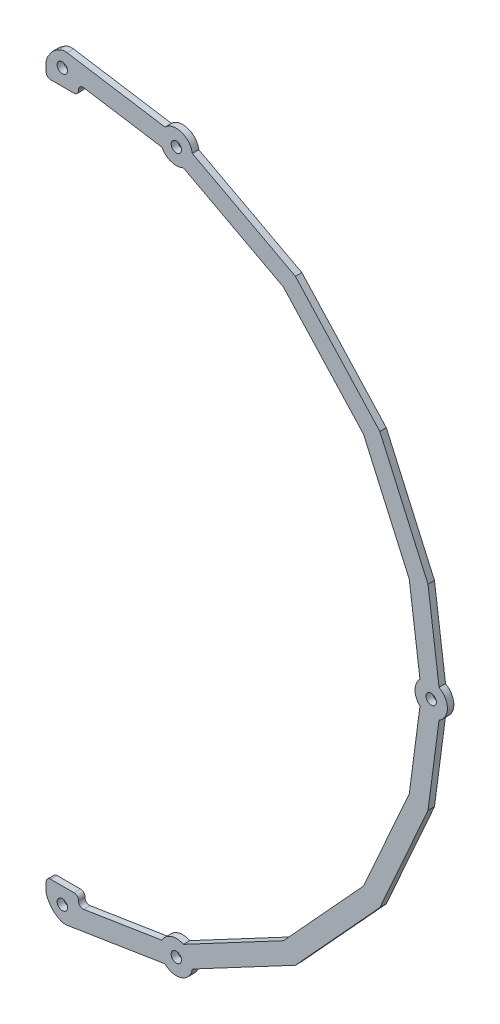
from build123d import *

# Parameters (mm, degrees)
EXTRUDE_180_DEPTH      = 8
EXTRUDE_START          = 8
SKETCH_2_W             = 6
SKETCH_2_H             = 4
EXTRUDE_457_DEPTH      = 36
EXTRUDE_START_2        = 44
EXTRUDE_180_2_DEPTH    = 3
SKETCH_4_R             = 20
SKETCH_4_R_2           = 4
EXTRUDE_692_DEPTH      = 3
EXTRUDE_745_DEPTH      = 3
EXTRUDE_1_DEPTH        = 3
EXTRUDE_Y_1_DEPTH      = 3
EXTRUDE_1_2_DEPTH      = 3
EXTRUDE_Y_1_2_DEPTH    = 3
CUT_EXTRUDE_START      = 44
CUT_EXTRUDE_1134_DEPTH = 3
SKETCH_11_R            = 5
EXTRUDE_1203_DEPTH     = 3
EXTRUDE_1416_DEPTH     = 8
SKETCH_13_R            = 1.6
CUT_EXTRUDE_1487_DEPTH = 3
SKETCH_14_R            = 1.6
CUT_EXTRUDE_1548_DEPTH = 8
CUT_EXTRUDE_START_2    = 8
SKETCH_15_W            = 600
SKETCH_15_H            = 600
CUT_EXTRUDE_1608_DEPTH = 60
F_2MM_DEPTH            = 8
SKETCH_17_R            = 5
EXTRUDE_M3_DEPTH       = 8
SKETCH_18_R            = 5
EXTRUDE_3_DEPTH        = 8
SKETCH_19_R            = 5
EXTRUDE_4_DEPTH        = 8
SKETCH_20_R            = 1.6
CUT_EXTRUDE_M3_DEPTH   = 8
F_40MM_4MM_D6P2_START  = 4
SKETCH_21_R            = 3.1
F_40MM_4MM_D6P2_DEPTH  = 4
R3P9_R                 = 3.9
F_2MM_0_2_START        = 2
SKETCH_22_W            = 600
SKETCH_22_H            = 600
F_2MM_0_2_DEPTH        = 8
FILLET_4_R             = 1.4


with BuildPart() as part:
    # 草图1 → Extrude 180 (new body)
    with BuildSketch(Plane.XY):
        Polygon((0, -115), (35.536954353, -109.371499374), (70.801069662, -90.621236665), (96.447115314, -62.633489027), (111.081470023, -29.764190187), (115, 0), (111.081470023, 29.764190187), (96.447115314, 62.633489027), (70.801069662, 90.621236665), (35.536954353, 109.371499374), (0, 115), (0, 111), (34.300886376, 105.567273309), (68.338423761, 87.46919365), (93.092433042, 60.454932887), (107.217766718, 28.728914006), (111, 0), (107.217766718, -28.728914006), (93.092433042, -60.454932887), (68.338423761, -87.46919365), (34.300886376, -105.567273309), (0, -111), align=None)
    extrude(amount=EXTRUDE_180_DEPTH)

    # 草图2 → Extrude 457 (add)
    with BuildSketch(Plane.XY.offset(EXTRUDE_START)):
        Polygon((35.584965419, -103.047126287), (37.439067386, -108.753465385), (33.634841321, -109.989533363), (31.780739354, -104.283194265), align=None)
        with Locations((112, 0)):
            Rectangle(SKETCH_2_W, SKETCH_2_H)
        Polygon((31.780739354, 104.283194265), (33.634841321, 109.989533363), (37.439067386, 108.753465385), (35.584965419, 103.047126287), align=None)
    extrude(amount=EXTRUDE_457_DEPTH)

    # 草图3 → Extrude 180 2 (add)
    with BuildSketch(Plane.XY.offset(EXTRUDE_START_2)):
        Polygon((0, -115), (35.536954353, -109.371499374), (70.801069662, -90.621236665), (96.447115314, -62.633489027), (111.081470023, -29.764190187), (115, 0), (111.081470023, 29.764190187), (96.447115314, 62.633489027), (70.801069662, 90.621236665), (35.536954353, 109.371499374), (0, 115), (0, 109), (33.682852387, 103.665160276), (67.10710081, 85.893172143), (91.415091906, 59.365654817), (105.285915066, 28.211275916), (109, 0), (105.285915066, -28.211275916), (91.415091906, -59.365654817), (67.10710081, -85.893172143), (33.682852387, -103.665160276), (0, -109), align=None)
    extrude(amount=EXTRUDE_180_2_DEPTH)



with BuildPart() as body_2:
    # 草图4 → Extrude 692 (new body)
    with BuildSketch(Plane.XY.offset(EXTRUDE_START_2)):
        Circle(SKETCH_4_R)
        Circle(SKETCH_4_R_2, mode=Mode.SUBTRACT)
    extrude(amount=EXTRUDE_692_DEPTH)


with BuildPart() as part_1:
    add(part.part)

    add(body_2.part)  # Extrude 745 merges body 2
    # 草图5 → Extrude 745 (add)
    with BuildSketch(Plane.XY.offset(EXTRUDE_START_2)):
        Polygon((17, -9), (113, -2.5), (113, 2.5), (17, 9), align=None)
    extrude(amount=EXTRUDE_745_DEPTH)

    # 草图6 → Extrude 1 (add)
    with BuildSketch(Plane.XY.offset(EXTRUDE_START_2)):
        Polygon((-5.736735419, -8.734652509), (31.330903272, -107.096180364), (26.669096728, -108.903819636), (-12.263264581, -11.265347491), align=None)
    extrude(amount=EXTRUDE_1_DEPTH)

    # 草图7 → Extrude Y__-1 (add)
    with BuildSketch(Plane.XY.offset(EXTRUDE_START_2)):
        Polygon((60.213265383, 1.279918343), (91.234949037, -66.240061243), (87.165050963, -68.159938757), (54.786734617, -1.279918343), align=None)
    extrude(amount=EXTRUDE_Y_1_DEPTH)

    # 草图8 → Extrude 1 2 (add)
    with BuildSketch(Plane.XY.offset(EXTRUDE_START_2)):
        Polygon((-12.263264581, 11.265347491), (26.669096728, 108.903819636), (31.330903272, 107.096180364), (-5.736735419, 8.734652509), align=None)
    extrude(amount=EXTRUDE_1_2_DEPTH)

    # 草图9 → Extrude Y__1 2 (add)
    with BuildSketch(Plane.XY.offset(EXTRUDE_START_2)):
        Polygon((54.786734617, 1.279918343), (87.165050963, 68.159938757), (91.234949037, 66.240061243), (60.213265383, -1.279918343), align=None)
    extrude(amount=EXTRUDE_Y_1_2_DEPTH)

    # 草图10 → Cut-Extrude 1134 (cut)
    with BuildSketch(Plane.XY.offset(CUT_EXTRUDE_START)):
        Polygon((18, -4.5), (18, 4.5), (80.33, 0), align=None)
    extrude(amount=CUT_EXTRUDE_1134_DEPTH, mode=Mode.SUBTRACT)

    # 草图11 → Extrude 1203 (add)
    with BuildSketch(Plane.XY.offset(EXTRUDE_START_2)):
        with Locations((0, 112)):
            Circle(SKETCH_11_R)
        with Locations((0, -112)):
            Circle(SKETCH_11_R)
    extrude(amount=EXTRUDE_1203_DEPTH)

    # 草图12 → Extrude 1416 (add)
    with BuildSketch(Plane.XY):
        Polygon((-5, -107), (5, -107), (5, -116.208077798), (0, -117), (-3, -115), (-5, -112), align=None)
        Polygon((-5, 107), (5, 107), (5, 116.208077798), (0, 117), (-3, 115), (-5, 112), align=None)
    extrude(amount=EXTRUDE_1416_DEPTH)

    # 草图13 → Cut-Extrude 1487 (cut)
    with BuildSketch(Plane.XY.offset(CUT_EXTRUDE_START)):
        with Locations((13.435028843, 0)):
            Circle(SKETCH_13_R)
        with Locations((-13.435028843, 0)):
            Circle(SKETCH_13_R)
        with Locations((0, 13.435028843)):
            Circle(SKETCH_13_R)
        with Locations((0, -13.435028843)):
            Circle(SKETCH_13_R)
        with Locations((0, 112)):
            Circle(SKETCH_13_R)
        with Locations((0, -112)):
            Circle(SKETCH_13_R)
    extrude(amount=CUT_EXTRUDE_1487_DEPTH, mode=Mode.SUBTRACT)

    # 草图14 → Cut-Extrude 1548 (cut)
    with BuildSketch(Plane.XY):
        with Locations((0, 112)):
            Circle(SKETCH_14_R)
        with Locations((0, -112)):
            Circle(SKETCH_14_R)
    extrude(amount=CUT_EXTRUDE_1548_DEPTH, mode=Mode.SUBTRACT)

    # 草图15 → Cut-Extrude 1608 (cut)
    with BuildSketch(Plane.XY.offset(CUT_EXTRUDE_START_2)):
        Rectangle(SKETCH_15_W, SKETCH_15_H)
    extrude(amount=CUT_EXTRUDE_1608_DEPTH, mode=Mode.SUBTRACT)

    # 草图16 → 外圈径向加厚2mm (add)
    with BuildSketch(Plane.XY):
        Polygon((0, -117), (36.154988342, -111.273612407), (72.032392613, -92.197258172), (98.12445645, -63.722767097), (113.013321676, -30.281828277), (117, 0), (113.013321676, 30.281828277), (98.12445645, 63.722767097), (72.032392613, 92.197258172), (36.154988342, 111.273612407), (0, 117), (0, 114), (35.227937359, 108.420442858), (70.185408187, 89.833225911), (95.608444746, 62.088849992), (110.115544197, 29.505371142), (114, 0), (110.115544197, -29.505371142), (95.608444746, -62.088849992), (70.185408187, -89.833225911), (35.227937359, -108.420442858), (0, -114), align=None)
    extrude(amount=F_2MM_DEPTH)

    # 草图17 → M3铝柱下定位耳 (add)
    with BuildSketch(Plane.XY):
        with Locations((35.227937359, -108.420442858)):
            Circle(SKETCH_17_R)
    extrude(amount=EXTRUDE_M3_DEPTH)

    # 草图18 → 凸台-拉伸3 (add)
    with BuildSketch(Plane.XY):
        with Locations((114, 0)):
            Circle(SKETCH_18_R)
    extrude(amount=EXTRUDE_3_DEPTH)

    # 草图19 → 凸台-拉伸4 (add)
    with BuildSketch(Plane.XY):
        with Locations((35.227937359, 108.420442858)):
            Circle(SKETCH_19_R)
    extrude(amount=EXTRUDE_4_DEPTH)

    # 草图20 → 三处M3下层固定孔 (cut)
    with BuildSketch(Plane.XY):
        with Locations((35.227937359, -108.420442858)):
            Circle(SKETCH_20_R)
        with Locations((114, 0)):
            Circle(SKETCH_20_R)
        with Locations((35.227937359, 108.420442858)):
            Circle(SKETCH_20_R)
    extrude(amount=CUT_EXTRUDE_M3_DEPTH, mode=Mode.SUBTRACT)

    # 草图21 → 40mm铝柱沉座_深4mm_D6p2 (cut)
    with BuildSketch(Plane.XY.offset(F_40MM_4MM_D6P2_START)):
        with Locations((35.227937359, -108.420442858)):
            Circle(SKETCH_21_R)
        with Locations((114, 0)):
            Circle(SKETCH_21_R)
        with Locations((35.227937359, 108.420442858)):
            Circle(SKETCH_21_R)
    extrude(amount=F_40MM_4MM_D6P2_DEPTH, mode=Mode.SUBTRACT)

    # 下端耳外缘圆角_R3p9_轮廓内收
    r3p9_edges = [part_1.edges().sort_by_distance(p)[0] for p in [
        (-5, -112, 4),
        (-3, -115, 4),
        (0, -117, 4),
        (-5, 112, 4),
        (0, 117, 4),
        (-3, 115, 4),
    ]]
    fillet(r3p9_edges, radius=R3P9_R)

    # 草图22 → 统一2mm板厚_下层保留0至2 (cut)
    with BuildSketch(Plane.XY.offset(F_2MM_0_2_START)):
        Rectangle(SKETCH_22_W, SKETCH_22_H)
    extrude(amount=F_2MM_0_2_DEPTH, mode=Mode.SUBTRACT)

    # 圆角4
    fillet_4_edges = [part_1.edges().sort_by_distance(p)[0] for p in [
        (5, 110.208077798, 1),
        (5, 107, 1),
        (-5, 107, 1),
        (-5, -107, 1),
        (5, -107, 1),
        (5, -110.208077798, 1),
    ]]
    fillet(fillet_4_edges, radius=FILLET_4_R)


solid = part_1.part
